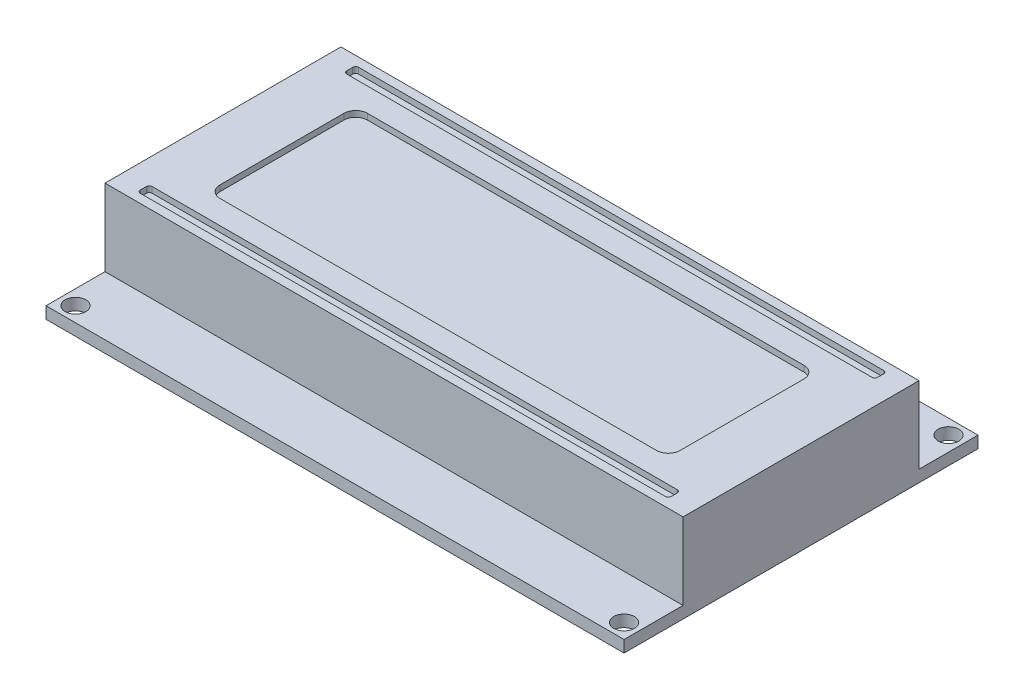
from build123d import *

# Parameters (mm, degrees)
SKETCH1_W           = 150
SKETCH1_H           = 55
SKETCH1_R           = 1.5
BOSS_EXTRUDE1_DEPTH = 2
SKETCH2_R           = 6
BOSS_EXTRUDE2_DEPTH = 10
SKETCH3_W           = 12
SKETCH3_H           = 12
BOSS_EXTRUDE3_DEPTH = 25
SKETCH4_W           = 5
SKETCH4_H           = 5
SKETCH4_W_2         = 41
SKETCH4_H_2         = 3
BOSS_EXTRUDE4_DEPTH = 5
SKETCH5_W           = 41
SKETCH5_H           = 3
SKETCH5_W_2         = 5
SKETCH5_H_2         = 5
SKETCH5_R           = 1.5
CUT_EXTRUDE1_DEPTH  = 2
SKETCH6_W           = 12
SKETCH6_H           = 12
CUT_EXTRUDE2_DEPTH  = 13
SKETCH7_W           = 12
SKETCH7_H           = 12
SKETCH7_R           = 3.5
CUT_EXTRUDE3_DEPTH  = 7
SKETCH8_R           = 1.25
CUT_EXTRUDE4_DEPTH  = 5
BOSS_EXTRUDE5_DEPTH = 3
SKETCH10_W          = 25
SKETCH10_H          = 1.5
CUT_EXTRUDE5_DEPTH  = 18
SKETCH11_W          = 98
SKETCH11_H          = 60
SKETCH11_R          = 1.75
BOSS_EXTRUDE6_DEPTH = 2
SKETCH12_W          = 98
SKETCH12_H          = 40
BOSS_EXTRUDE7_DEPTH = 13
CUT_EXTRUDE6_DEPTH  = 1
SKETCH14_W          = 25
SKETCH14_H          = 1.5
BOSS_EXTRUDE8_DEPTH = 29
SKETCH15_W          = 160
SKETCH15_H          = 64
CUT_EXTRUDE7_DEPTH  = 8
SKETCH16_W          = 38
SKETCH16_H          = 64
CUT_EXTRUDE8_DEPTH  = 152.907866814


with BuildPart() as part:
    # Sketch1 → Boss-Extrude1 (new body)
    with BuildSketch(Plane(origin=(0, 0, 0), x_dir=(1, 0, 0), z_dir=(0, 1, 0))):
        with Locations((75, 27.5)):
            Rectangle(SKETCH1_W, SKETCH1_H)
        with Locations(Location((3, 52, 0), (0, 0, 270))):
            Circle(SKETCH1_R, mode=Mode.SUBTRACT)
        with Locations(Location((147, 52, 0), (0, 0, 90))):
            Circle(SKETCH1_R, mode=Mode.SUBTRACT)
        with Locations(Location((147, 3, 0), (0, 0, 270))):
            Circle(SKETCH1_R, mode=Mode.SUBTRACT)
        with Locations(Location((3, 3, 0), (0, 0, 90))):
            Circle(SKETCH1_R, mode=Mode.SUBTRACT)
    extrude(amount=BOSS_EXTRUDE1_DEPTH)

    # Sketch2 → Boss-Extrude2 (add)
    with BuildSketch(Plane(origin=(0, 2, 0), x_dir=(1, 0, 0), z_dir=(0, 1, 0))):
        with Locations(Location((13, 10, 0), (0, 0, 90))):
            Circle(SKETCH2_R)
    extrude(amount=BOSS_EXTRUDE2_DEPTH)

    # Sketch3 → Boss-Extrude3 (add)
    with BuildSketch(Plane(origin=(0, 2, 0), x_dir=(1, 0, 0), z_dir=(0, 1, 0))):
        with Locations((13, 27.5)):
            Rectangle(SKETCH3_W, SKETCH3_H)
    extrude(amount=BOSS_EXTRUDE3_DEPTH)

    # Sketch4 → Boss-Extrude4 (add)
    with BuildSketch(Plane(origin=(0, 2, 0), x_dir=(1, 0, 0), z_dir=(0, 1, 0))):
        with Locations((13, 43)):
            Rectangle(SKETCH4_W, SKETCH4_H)
        with Locations((106.5, 6.5)):
            Rectangle(SKETCH4_W_2, SKETCH4_H_2)
    extrude(amount=BOSS_EXTRUDE4_DEPTH)

    # Sketch5 → Cut-Extrude1 (cut)
    # profile 1 of 2: a face of its own
    with BuildSketch(Plane(origin=(0, 7, 0), x_dir=(1, 0, 0), z_dir=(0, 1, 0))):
        with Locations((106.5, 6.5)):
            Rectangle(SKETCH5_W, SKETCH5_H)
    # profile 2 of 2: a face of its own
    with BuildSketch(Plane(origin=(0, 7, 0), x_dir=(1, 0, 0), z_dir=(0, 1, 0))):
        with Locations((13, 43)):
            Rectangle(SKETCH5_W_2, SKETCH5_H_2)
        with Locations(Location((13, 43, 0), (0, 0, 270))):
            Circle(SKETCH5_R, mode=Mode.SUBTRACT)
    extrude(amount=-CUT_EXTRUDE1_DEPTH, mode=Mode.SUBTRACT)

    # Sketch6 → Cut-Extrude2 (cut)
    with BuildSketch(Plane(origin=(0, 27, 0), x_dir=(1, 0, 0), z_dir=(0, 1, 0))):
        with Locations((13, 27.5)):
            Rectangle(SKETCH6_W, SKETCH6_H)
        with BuildLine():
            Line((10.370614338, 26.055586264), (15.629385662, 26.055586264))
            ThreePointArc((15.629385662, 26.055586264), (13, 30.5), (10.370614338, 26.055586264))
        make_face(mode=Mode.SUBTRACT)
    extrude(amount=-CUT_EXTRUDE2_DEPTH, mode=Mode.SUBTRACT)

    # Sketch7 → Cut-Extrude3 (cut)
    with BuildSketch(Plane(origin=(0, 14, 0), x_dir=(1, 0, 0), z_dir=(0, 1, 0))):
        with Locations((13, 27.5)):
            Rectangle(SKETCH7_W, SKETCH7_H)
        with Locations(Location((13, 27.5, 0), (0, 0, 270))):
            Circle(SKETCH7_R, mode=Mode.SUBTRACT)
    extrude(amount=-CUT_EXTRUDE3_DEPTH, mode=Mode.SUBTRACT)

    # Sketch8 → Cut-Extrude4 (cut)
    with BuildSketch(Plane(origin=(0, 12, 0), x_dir=(1, 0, 0), z_dir=(0, 1, 0))):
        with Locations(Location((13, 10, 0), (0, 0, 270))):
            Circle(SKETCH8_R)
    extrude(amount=-CUT_EXTRUDE4_DEPTH, mode=Mode.SUBTRACT)

    # Sketch9 → Boss-Extrude5 (add)
    with BuildSketch(Plane.XZ):
        Polygon((149, -20), (131, -20), (129, -22), (124, -22), (124, -47), (149, -47), align=None)
    extrude(amount=BOSS_EXTRUDE5_DEPTH)

    # Sketch10 → Cut-Extrude5 (cut)
    with BuildSketch(Plane(origin=(149, 0, 0), x_dir=(0, 0, -1), z_dir=(1, 0, 0))):
        with Locations((33.5, -1.5)):
            Rectangle(SKETCH10_W, SKETCH10_H)
    extrude(amount=-CUT_EXTRUDE5_DEPTH, mode=Mode.SUBTRACT)

    # Sketch11 → Boss-Extrude6 (add)
    with BuildSketch(Plane(origin=(0, 5, 0), x_dir=(1, 0, 0), z_dir=(0, 1, 0))):
        with Locations((87, 34)):
            Rectangle(SKETCH11_W, SKETCH11_H)
        with Locations(Location((40.5, 61.5, 0), (0, 0, 270))):
            Circle(SKETCH11_R, mode=Mode.SUBTRACT)
        with Locations(Location((133.5, 61.5, 0), (0, 0, 90))):
            Circle(SKETCH11_R, mode=Mode.SUBTRACT)
        with Locations(Location((133.5, 6.5, 0), (0, 0, 270))):
            Circle(SKETCH11_R, mode=Mode.SUBTRACT)
        with Locations(Location((40.5, 6.5, 0), (0, 0, 90))):
            Circle(SKETCH11_R, mode=Mode.SUBTRACT)
    extrude(amount=BOSS_EXTRUDE6_DEPTH)

    # Sketch12 → Boss-Extrude7 (add)
    with BuildSketch(Plane(origin=(0, 7, 0), x_dir=(1, 0, 0), z_dir=(0, 1, 0))):
        with Locations((87, 34)):
            Rectangle(SKETCH12_W, SKETCH12_H)
    extrude(amount=BOSS_EXTRUDE7_DEPTH)

    # Sketch13 → Cut-Extrude6 (cut)
    with BuildSketch(Plane(origin=(0, 20, 0), x_dir=(1, 0, 0), z_dir=(0, 1, 0))):
        with BuildLine():
            Line((50, 46.5), (124, 46.5))
            ThreePointArc((124, 46.5), (125.414213562, 45.914213562), (126, 44.5))
            Line((126, 44.5), (126, 23.5))
            ThreePointArc((126, 23.5), (125.414213562, 22.085786438), (124, 21.5))
            Line((124, 21.5), (50, 21.5))
            ThreePointArc((50, 21.5), (48.585786438, 22.085786438), (48, 23.5))
            Line((48, 23.5), (48, 44.5))
            ThreePointArc((48, 44.5), (48.585786438, 45.914213562), (50, 46.5))
        make_face()
        with BuildLine():
            Line((42.5, 52.5), (131.5, 52.5))
            ThreePointArc((131.5, 52.5), (131.853553391, 52.353553391), (132, 52))
            Line((132, 52), (132, 51))
            ThreePointArc((132, 51), (131.853553391, 50.646446609), (131.5, 50.5))
            Line((131.5, 50.5), (42.5, 50.5))
            ThreePointArc((42.5, 50.5), (42.146446609, 50.646446609), (42, 51))
            Line((42, 51), (42, 52))
            ThreePointArc((42, 52), (42.146446609, 52.353553391), (42.5, 52.5))
        make_face()
        with BuildLine():
            Line((132, 16), (132, 17))
            ThreePointArc((132, 17), (131.853553391, 17.353553391), (131.5, 17.5))
            Line((131.5, 17.5), (42.5, 17.5))
            ThreePointArc((42.5, 17.5), (42.146446609, 17.353553391), (42, 17))
            Line((42, 17), (42, 16))
            ThreePointArc((42, 16), (42.146446609, 15.646446609), (42.5, 15.5))
            Line((42.5, 15.5), (131.5, 15.5))
            ThreePointArc((131.5, 15.5), (131.853553391, 15.646446609), (132, 16))
        make_face()
    extrude(amount=-CUT_EXTRUDE6_DEPTH, mode=Mode.SUBTRACT)

    # Sketch14 → Boss-Extrude8 (add)
    with BuildSketch(Plane(origin=(131, 0, 0), x_dir=(0, 0, -1), z_dir=(1, 0, 0))):
        with Locations((33.5, -1.5)):
            Rectangle(SKETCH14_W, SKETCH14_H)
    extrude(amount=BOSS_EXTRUDE8_DEPTH)

    # Sketch15 → Cut-Extrude7 (cut)
    with BuildSketch(Plane.XZ.offset(3)):
        with Locations((80, -32)):
            Rectangle(SKETCH15_W, SKETCH15_H)
    extrude(amount=-CUT_EXTRUDE7_DEPTH, mode=Mode.SUBTRACT)


with BuildPart() as cut_extrude7_piece_1:
    # of the separate pieces the step leaves, piece 1, a body of its own (cut_extrude7_pieces)
    add(part.part.solids().sort_by_distance((136, 5, -64))[0])


with BuildPart() as cut_extrude7_piece_2:
    # of the separate pieces the step leaves, piece 2, a body of its own (cut_extrude7_pieces)
    add(part.part.solids().sort_by_distance((7, 5, -21.5))[0])


with BuildPart() as cut_extrude7_piece_3:
    # of the separate pieces the step leaves, piece 3, a body of its own (cut_extrude7_pieces)
    add(part.part.solids().sort_by_distance((13, 5, -16))[0])


with BuildPart() as cut_extrude7_piece_4:
    # of the separate pieces the step leaves, piece 4, a body of its own (cut_extrude7_pieces)
    add(part.part.solids().sort_by_distance((13, 7, -41.5))[0])


with BuildPart() as cut_extrude8_tool:
    # Sketch16 → Cut-Extrude8 (new, through all)
    with BuildSketch(Plane.XZ.offset(-5)):
        with Locations((19, -32)):
            Rectangle(SKETCH16_W, SKETCH16_H)
    extrude(amount=-CUT_EXTRUDE8_DEPTH)


with BuildPart() as cut_extrude7_piece_2_1:
    add(cut_extrude7_piece_2.part)

    # Cut-Extrude8: cut by cut_extrude8_tool
    add(cut_extrude8_tool.part, mode=Mode.SUBTRACT)


with BuildPart() as cut_extrude7_piece_3_1:
    add(cut_extrude7_piece_3.part)

    # Cut-Extrude8: cut by cut_extrude8_tool
    add(cut_extrude8_tool.part, mode=Mode.SUBTRACT)


with BuildPart() as cut_extrude7_piece_4_1:
    add(cut_extrude7_piece_4.part)

    # Cut-Extrude8: cut by cut_extrude8_tool
    add(cut_extrude8_tool.part, mode=Mode.SUBTRACT)


solid = cut_extrude7_piece_1.part
